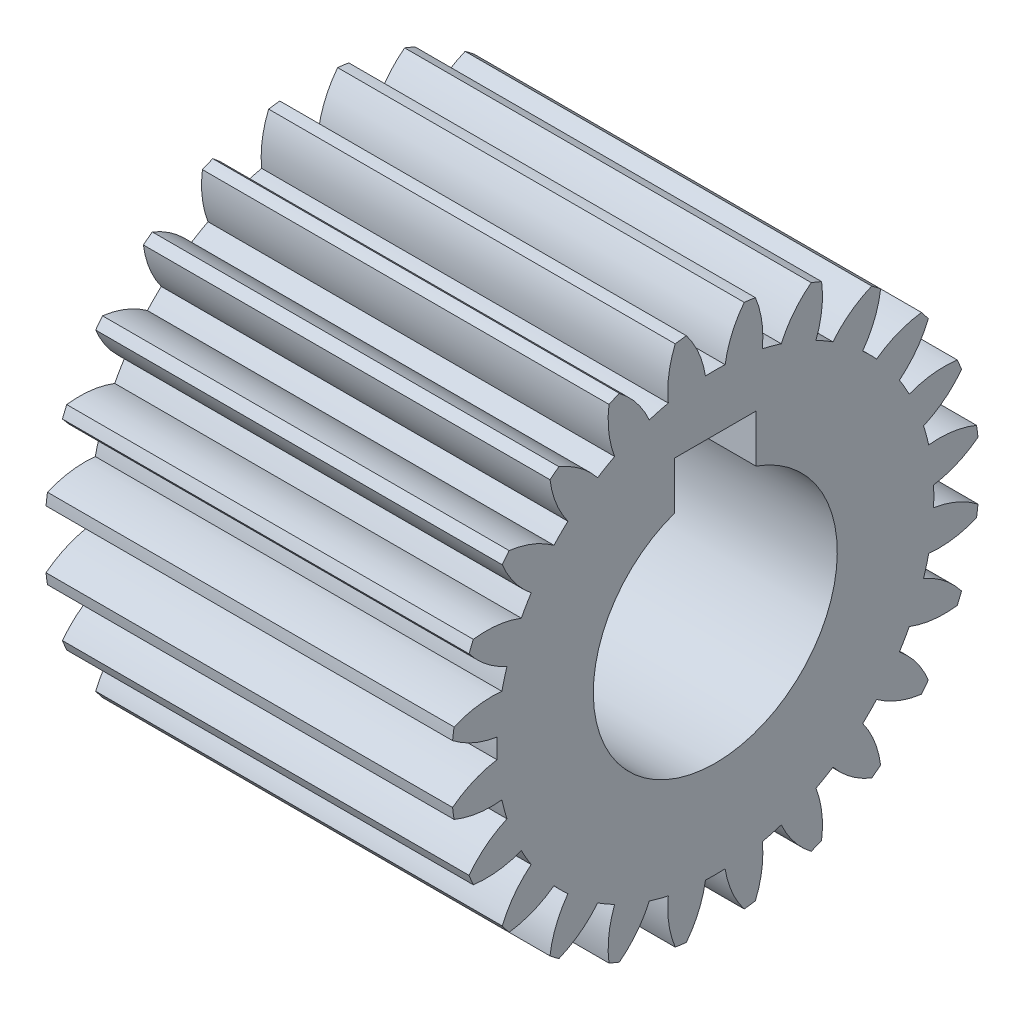
from build123d import *

# Parameters (mm, degrees)
BASPROSKE_W     = 10
BASPROSKE_H     = 6.5
TOOTHCUT_DEPTH  = 14.583077707
TEETHCUTS_COUNT = 24
TEETHCUTS_ANGLE = 345
BORSKE_R        = 3
BORE_DEPTH      = 50.0000508
KEYSKE_W        = 2
KEYSKE_H        = 4
KEYWAY_DEPTH    = 50.0000508


with BuildPart() as part:
    # BasProSke → Base-Revolve (revolve)
    with BuildSketch(Plane(origin=(0, 0, 0), x_dir=(1, 0, 0), z_dir=(0, 1, 0)), mode=Mode.PRIVATE) as base_revolve_sk:
        with Locations((5, 3.25)):
            Rectangle(BASPROSKE_W, BASPROSKE_H)
    revolve(base_revolve_sk.sketch.rotate(Axis((-10, 0, 0), (1, 0, 0)), 180), axis=Axis((-10, 0, 0), (1, 0, 0)))

    # TooCutSke → ToothCut (cut, through all)
    with BuildSketch(Plane(origin=(0, 0, 0), x_dir=(0, 0, -1), z_dir=(1, 0, 0))):
        with BuildLine():
            ThreePointArc((0.241646108, 5.368564348), (0, 5.374), (-0.241646108, 5.368564348))
            ThreePointArc((-0.241646108, 5.368564348), (-0.413699957, 5.957993365), (-0.729686037, 6.48447403))
            ThreePointArc((-0.729686037, 6.48447403), (0, 6.5254), (0.729686037, 6.48447403))
            ThreePointArc((0.729686037, 6.48447403), (0.413699957, 5.957993365), (0.241646108, 5.368564348))
        make_face()
    toothcut = extrude(amount=TOOTHCUT_DEPTH, mode=Mode.SUBTRACT)

    # TeethCuts: ToothCut ×24 about axis
    teethcuts_axis = Axis((-10, 0, 0), (1, 0, 0))
    for i in range(1, TEETHCUTS_COUNT):
        add(toothcut.rotate(teethcuts_axis, i * TEETHCUTS_ANGLE / (TEETHCUTS_COUNT - 1)), mode=Mode.SUBTRACT)

    # BorSke → Bore (cut, symmetric)
    with BuildSketch(Plane(origin=(0, 0, 0), x_dir=(0, 0, -1), z_dir=(1, 0, 0))):
        with Locations(Location((0, 0, 0), (0, 0, 180))):
            Circle(BORSKE_R)
    extrude(amount=BORE_DEPTH, both=True, mode=Mode.SUBTRACT)

    # KeySke → Keyway (cut, symmetric)
    with BuildSketch(Plane(origin=(0, 0, 0), x_dir=(0, 0, -1), z_dir=(1, 0, 0))):
        with Locations((0, 2)):
            Rectangle(KEYSKE_W, KEYSKE_H)
    extrude(amount=KEYWAY_DEPTH, both=True, mode=Mode.SUBTRACT)


solid = part.part
